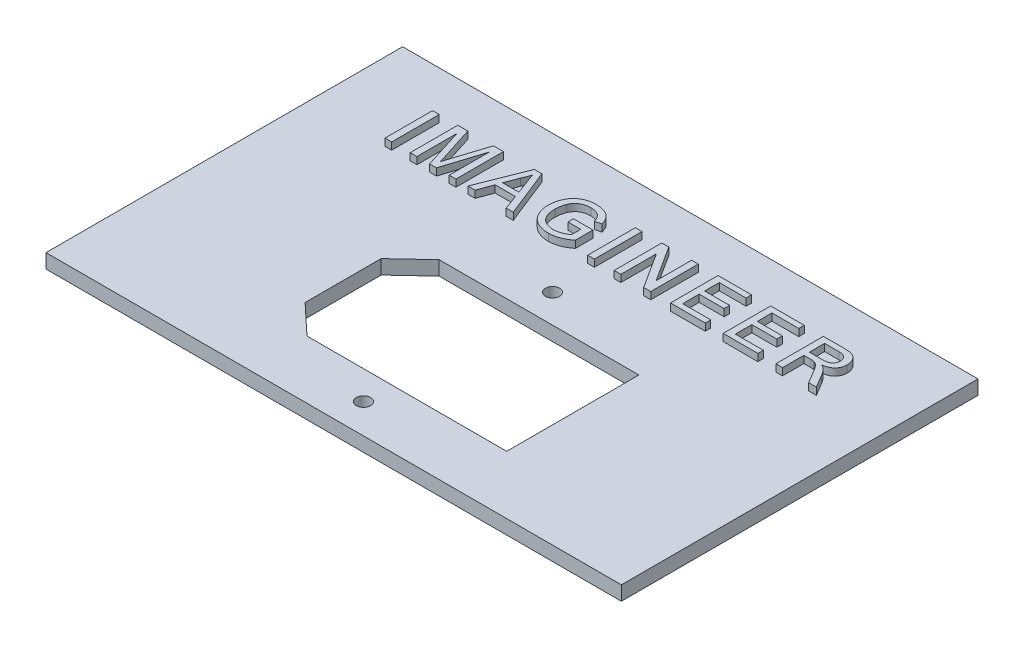
from build123d import *

# Parameters (mm, degrees)
SKETCH1_W           = 121
SKETCH1_H           = 75
BOSS_EXTRUDE1_DEPTH = 58
SKETCH2_W           = 115
SKETCH2_H           = 52
CUT_EXTRUDE1_DEPTH  = 72
SKETCH4_W           = 1.41025641
SKETCH4_H           = 10
BOSS_EXTRUDE2_DEPTH = 1.5
SKETCH5_R           = 1.489811861
SKETCH5_R_2         = 1.5
CUT_EXTRUDE2_DEPTH  = 5
SKETCH6_W           = 75
SKETCH6_H           = 3
BOSS_EXTRUDE3_DEPTH = 20
SKETCH7_R           = 2.5
CUT_EXTRUDE3_DEPTH  = 20
SKETCH8_R           = 7.5
CUT_EXTRUDE4_DEPTH  = 5
SKETCH9_R           = 1.75
CUT_EXTRUDE5_DEPTH  = 5
SKETCH11_W          = 152.738071066
SKETCH11_H          = 55
CUT_EXTRUDE7_DEPTH  = 171.429604315


with BuildPart() as part:
    # Sketch1 → Boss-Extrude1 (new body)
    with BuildSketch(Plane(origin=(0, 0, 0), x_dir=(1, 0, 0), z_dir=(0, 1, 0))):
        with Locations((60.5, 37.5)):
            Rectangle(SKETCH1_W, SKETCH1_H)
    extrude(amount=BOSS_EXTRUDE1_DEPTH)

    # Sketch2 → Cut-Extrude1 (cut)
    with BuildSketch(Plane(origin=(0, 0, -75), x_dir=(-1, 0, 0), z_dir=(0, 0, -1))):
        with Locations((-60.5, 29)):
            Rectangle(SKETCH2_W, SKETCH2_H)
    extrude(amount=-CUT_EXTRUDE1_DEPTH, mode=Mode.SUBTRACT)

    # Sketch4 → Boss-Extrude2 (add)
    # profile 1 of 9: a face of its own
    with BuildSketch(Plane(origin=(0, 58, 0), x_dir=(1, 0, 0), z_dir=(0, 1, 0))):
        with Locations((16.987179487, 60)):
            Rectangle(SKETCH4_W, SKETCH4_H)
    # profile 2 of 9: a face of its own
    with BuildSketch(Plane(origin=(0, 58, 0), x_dir=(1, 0, 0), z_dir=(0, 1, 0))):
        with BuildLine():
            Line((21.58974359, 55), (21.58974359, 65))
            Line((21.58974359, 65), (23.711137821, 65))
            Line((23.711137821, 65), (25.946714744, 57.982772436))
            add(Edge.make_bspline(
                [(25.946714744, 57.982772436), (25.971317363, 57.903279477), (26.018897396, 57.749544721), (26.08945294, 57.527537588), (26.153646657, 57.321231721), (26.211463207, 57.129970438), (26.266025433, 56.954703341), (26.313267723, 56.793992236), (26.358432889, 56.649622979), (26.384901695, 56.557871596), (26.397435897, 56.514423077)],
                knots=[0, 0, 0, 0, 1.300204174, 2.514519184, 3.639827924, 4.676153899, 5.636536826, 6.507959918, 7.293450077, 8, 8, 8, 8], degree=3))
            add(Edge.make_bspline(
                [(26.397435897, 56.514423077), (26.411396089, 56.561850935), (26.441104268, 56.662780451), (26.489265976, 56.821474812), (26.540511404, 56.997087981), (26.601836474, 57.186601452), (26.665760601, 57.392988098), (26.732857292, 57.61607652), (26.810252019, 57.853639448), (26.861684683, 58.018107915), (26.888221154, 58.102964744)],
                knots=[0, 0, 0, 0, 0.713638162, 1.518667645, 2.393860736, 3.354087503, 4.393659122, 5.512594909, 6.716633584, 8, 8, 8, 8], degree=3))
            Line((26.888221154, 58.102964744), (29.101762821, 65))
            Line((29.101762821, 65), (31.205128205, 65))
            Line((31.205128205, 65), (31.205128205, 55))
            Line((31.205128205, 55), (29.794871795, 55))
            Line((29.794871795, 55), (29.794871795, 63.461538462))
            Line((29.794871795, 63.461538462), (27.126602564, 55))
            Line((27.126602564, 55), (25.65224359, 55))
            Line((25.65224359, 55), (23, 63.461538462))
            Line((23, 63.461538462), (23, 55))
            Line((23, 55), (21.58974359, 55))
        make_face()
    # profile 3 of 9: a face of its own
    with BuildSketch(Plane(origin=(0, 58, 0), x_dir=(1, 0, 0), z_dir=(0, 1, 0))):
        Polygon((33.734375, 55), (37.704727564, 65), (39.295272436, 65), (43.265625, 55), (41.769230769, 55), (40.631410256, 58.076923077), (36.368589744, 58.076923077), (35.230769231, 55), align=None)
        with BuildLine():
            Line((36.793269231, 59.230769231), (40.206730769, 59.230769231))
            Line((40.206730769, 59.230769231), (39.235176282, 61.858974359))
            add(Edge.make_bspline(
                [(39.235176282, 61.858974359), (39.197930352, 61.960524623), (39.125107525, 62.159074565), (39.016506752, 62.447550868), (38.917290835, 62.721499806), (38.820001481, 62.976993344), (38.732176644, 63.217742781), (38.65122624, 63.442121964), (38.571166974, 63.648571351), (38.523122282, 63.781958927), (38.5, 63.846153846)],
                knots=[0, 0, 0, 0, 1.225184869, 2.395467751, 3.491410812, 4.525364584, 5.492066482, 6.394148129, 7.227157926, 8, 8, 8, 8], degree=3))
            add(Edge.make_bspline(
                [(38.5, 63.846153846), (38.461751283, 63.687854829), (38.385096138, 63.370604078), (38.224598927, 62.905789169), (38.040995692, 62.445225202), (37.891887987, 62.148440925), (37.816907051, 61.999198718)],
                knots=[0, 0, 0, 0, 0.9891762, 1.982431084, 2.985436691, 4, 4, 4, 4], degree=3))
            Line((37.816907051, 61.999198718), (36.793269231, 59.230769231))
        make_face(mode=Mode.SUBTRACT)
    # profile 4 of 9: a face of its own
    with BuildSketch(Plane(origin=(0, 58, 0), x_dir=(1, 0, 0), z_dir=(0, 1, 0))):
        with BuildLine():
            Line((50.794871795, 58.974358974), (50.794871795, 60.128205128))
            Line((50.794871795, 60.128205128), (54.897435897, 60.128205128))
            Line((54.897435897, 60.128205128), (54.897435897, 56.428285256))
            add(Edge.make_bspline(
                [(54.897435897, 56.428285256), (54.73556896, 56.305002849), (54.416994741, 56.062367775), (53.917376037, 55.745937247), (53.409562732, 55.477566549), (52.894958248, 55.256008429), (52.371793817, 55.085009754), (51.842328107, 54.962612928), (51.305984536, 54.885088148), (50.945369884, 54.876229875), (50.764823718, 54.871794872)],
                knots=[0, 0, 0, 0, 1.08433114, 2.134098231, 3.14842993, 4.143565882, 5.117308249, 6.078377492, 7.037916032, 8, 8, 8, 8], degree=3))
            add(Edge.make_bspline(
                [(50.764823718, 54.871794872), (50.64389522, 54.87365123), (50.40366656, 54.877338949), (50.047995823, 54.908887566), (49.700630006, 54.955764326), (49.362227986, 55.024694072), (49.031595068, 55.112449203), (48.709368093, 55.220898845), (48.395411996, 55.347451318), (48.091476855, 55.49253813), (47.802131001, 55.658770426), (47.528170608, 55.841031042), (47.273051762, 56.0420657), (47.036381783, 56.260230047), (46.819016407, 56.496822026), (46.617735084, 56.748697136), (46.437936839, 57.020470861), (46.275651434, 57.307144136), (46.132352841, 57.606547618), (46.007233593, 57.916126264), (45.903810689, 58.235137402), (45.817554604, 58.562169756), (45.748959138, 58.897100071), (45.701047331, 59.240978048), (45.672844116, 59.593540684), (45.668739297, 59.831680225), (45.666666667, 59.951923077)],
                knots=[0, 0, 0, 0, 1.072770755, 2.131096365, 3.165876834, 4.181397123, 5.193125461, 6.199217581, 7.195986042, 8.195005739, 9.184865672, 10.154356418, 11.112044544, 12.063776475, 13.007136321, 13.960176652, 14.921449994, 15.895149614, 16.88092309, 17.86448639, 18.855604391, 19.854360534, 20.864074582, 21.88711945, 22.933151623, 24, 24, 24, 24], degree=3))
            add(Edge.make_bspline(
                [(45.666666667, 59.951923077), (45.668744997, 60.071498178), (45.672872481, 60.308969721), (45.701316611, 60.662837854), (45.749403968, 61.01051012), (45.815790489, 61.352185335), (45.899570126, 61.687567122), (46.003941343, 62.016720404), (46.128812684, 62.339343656), (46.270237862, 62.654755101), (46.427750978, 62.958441784), (46.60863962, 63.240698377), (46.798821071, 63.508119853), (47.013985843, 63.749080405), (47.239158795, 63.976021204), (47.485357478, 64.178003002), (47.746376315, 64.361105929), (48.023344215, 64.523362037), (48.314631955, 64.664963992), (48.616763548, 64.789673635), (48.930424699, 64.893159395), (49.253817605, 64.980468389), (49.588734219, 65.045340341), (49.934311274, 65.094139841), (50.290939241, 65.12201267), (50.532405627, 65.126123852), (50.654647436, 65.128205128)],
                knots=[0, 0, 0, 0, 1.059979929, 2.105079288, 3.144800512, 4.169876923, 5.189194625, 6.207600986, 7.228841866, 8.254191695, 9.270945245, 10.257936415, 11.22408152, 12.176290364, 13.118065146, 14.055588944, 14.994904974, 15.942096138, 16.897776019, 17.864011786, 18.837383209, 19.823806203, 20.831455606, 21.859450402, 22.916351634, 24, 24, 24, 24], degree=3))
            add(Edge.make_bspline(
                [(50.654647436, 65.128205128), (50.831115136, 65.123959635), (51.175909745, 65.115664501), (51.68071161, 65.051149166), (52.158134205, 64.940754438), (52.536487652, 64.813922736), (52.8206613, 64.690323441), (53.021530624, 64.590430295), (53.21034398, 64.481348357), (53.389274769, 64.366622463), (53.554327508, 64.238724287), (53.707670997, 64.103667865), (53.84970877, 63.959833891), (54.024578118, 63.754555172), (54.224621182, 63.469402744), (54.425338507, 63.082182228), (54.601142318, 62.650536201), (54.688153937, 62.341423111), (54.733173077, 62.181490385)],
                knots=[0, 0, 0, 0, 1.539867261, 3.008697525, 4.432261777, 5.810773619, 6.484177873, 7.135742803, 7.767512201, 8.386601754, 8.989234153, 9.587908519, 10.168964172, 10.7517707, 11.940093668, 13.199243526, 14.550910222, 16, 16, 16, 16], degree=3))
            Line((54.733173077, 62.181490385), (53.443108974, 61.856971154))
            add(Edge.make_bspline(
                [(53.443108974, 61.856971154), (53.405874484, 61.975646851), (53.334562136, 62.202937264), (53.208953288, 62.520609667), (53.062629557, 62.794917237), (52.906173437, 63.03636924), (52.719779789, 63.244075818), (52.503369428, 63.428118249), (52.250462487, 63.587953021), (51.966628117, 63.724803039), (51.658050303, 63.836552659), (51.329620599, 63.916187516), (50.984682955, 63.965713987), (50.748968599, 63.971436756), (50.628605769, 63.974358974)],
                knots=[0, 0, 0, 0, 1.164883671, 2.23101188, 3.193404931, 4.072828119, 4.918883984, 5.797350418, 6.725503451, 7.712871826, 8.743577122, 9.793233972, 10.87315899, 12, 12, 12, 12], degree=3))
            add(Edge.make_bspline(
                [(50.628605769, 63.974358974), (50.486232797, 63.970769984), (50.21058126, 63.963821259), (49.811123469, 63.914008077), (49.441465873, 63.829030609), (49.102847471, 63.707944881), (48.796690432, 63.559104982), (48.518614342, 63.390799982), (48.273333297, 63.198120431), (48.059914961, 62.983524042), (47.874312424, 62.753957932), (47.708805657, 62.514669015), (47.564876039, 62.263726715), (47.488000882, 62.087442093), (47.449519231, 61.999198718)],
                knots=[0, 0, 0, 0, 1.282088634, 2.482280855, 3.618640035, 4.691464057, 5.71354971, 6.679981643, 7.61357903, 8.515091979, 9.399860987, 10.268958177, 11.133486685, 12, 12, 12, 12], degree=3))
            add(Edge.make_bspline(
                [(47.449519231, 61.999198718), (47.392055005, 61.843994267), (47.276389513, 61.5315947), (47.16339573, 61.039243874), (47.090456723, 60.528375998), (47.081479537, 60.180549305), (47.076923077, 60.00400641)],
                knots=[0, 0, 0, 0, 0.971932623, 1.956331326, 2.96271565, 4, 4, 4, 4], degree=3))
            add(Edge.make_bspline(
                [(47.076923077, 60.00400641), (47.077613597, 59.895781102), (47.078966349, 59.683764253), (47.103212206, 59.372463708), (47.134914439, 59.073836949), (47.186365485, 58.789348439), (47.247536072, 58.518150279), (47.323409115, 58.260094134), (47.416152527, 58.016468037), (47.519741217, 57.784886293), (47.638264501, 57.567850479), (47.770253043, 57.365591733), (47.915216958, 57.178217942), (48.072661906, 57.005522406), (48.240252343, 56.844036102), (48.423236889, 56.699921497), (48.619557882, 56.571085484), (48.89498827, 56.417657457), (49.258151731, 56.262770224), (49.70831801, 56.124579887), (50.173570392, 56.042505126), (50.488064727, 56.031293828), (50.646634615, 56.025641026)],
                knots=[0, 0, 0, 0, 1.070760406, 2.097653971, 3.088708526, 4.041547766, 4.95691435, 5.839291284, 6.700934147, 7.534993757, 8.348268852, 9.145600082, 9.922850605, 10.690119832, 11.456705726, 12.223547942, 12.991528328, 13.778467112, 15.341275849, 16.888285822, 18.431055468, 20, 20, 20, 20], degree=3))
            add(Edge.make_bspline(
                [(50.646634615, 56.025641026), (50.785735052, 56.030218875), (51.063294813, 56.039353473), (51.476523468, 56.102740525), (51.883255685, 56.210373903), (52.27650153, 56.355690977), (52.644357284, 56.52213959), (52.96997267, 56.700489064), (53.252725699, 56.878452619), (53.411773916, 57.014721263), (53.487179487, 57.079326923)],
                knots=[0, 0, 0, 0, 1.08078364, 2.156585965, 3.240205791, 4.344938036, 5.41078367, 6.374425311, 7.229306744, 8, 8, 8, 8], degree=3))
            Line((53.487179487, 57.079326923), (53.487179487, 58.974358974))
            Line((53.487179487, 58.974358974), (50.794871795, 58.974358974))
        make_face()
    # profile 5 of 9: a face of its own
    with BuildSketch(Plane(origin=(0, 58, 0), x_dir=(1, 0, 0), z_dir=(0, 1, 0))):
        with Locations((59.628205128, 60)):
            Rectangle(SKETCH4_W, SKETCH4_H)
    # profile 6 of 9: a face of its own
    with BuildSketch(Plane(origin=(0, 58, 0), x_dir=(1, 0, 0), z_dir=(0, 1, 0))):
        Polygon((64.487179487, 55), (64.487179487, 65), (65.977564103, 65), (70.769230769, 57.538060897), (70.769230769, 65), (72.179487179, 65), (72.179487179, 55), (70.689102564, 55), (65.897435897, 62.461939103), (65.897435897, 55), align=None)
    # profile 7 of 9: a face of its own
    with BuildSketch(Plane(origin=(0, 58, 0), x_dir=(1, 0, 0), z_dir=(0, 1, 0))):
        Polygon((76.333333333, 55), (76.333333333, 65), (83.384615385, 65), (83.384615385, 63.846153846), (77.743589744, 63.846153846), (77.743589744, 60.769230769), (83, 60.769230769), (83, 59.615384615), (77.743589744, 59.615384615), (77.743589744, 56.153846154), (83.641025641, 56.153846154), (83.641025641, 55), align=None)
    # profile 8 of 9: a face of its own
    with BuildSketch(Plane(origin=(0, 58, 0), x_dir=(1, 0, 0), z_dir=(0, 1, 0))):
        Polygon((87.41025641, 55), (87.41025641, 65), (94.461538462, 65), (94.461538462, 63.846153846), (88.820512821, 63.846153846), (88.820512821, 60.769230769), (94.076923077, 60.769230769), (94.076923077, 59.615384615), (88.820512821, 59.615384615), (88.820512821, 56.153846154), (94.717948718, 56.153846154), (94.717948718, 55), align=None)
    # profile 9 of 9: a face of its own
    with BuildSketch(Plane(origin=(0, 58, 0), x_dir=(1, 0, 0), z_dir=(0, 1, 0))):
        with BuildLine():
            Line((98.487179487, 55), (98.487179487, 65))
            Line((98.487179487, 65), (102.826121795, 65))
            add(Edge.make_bspline(
                [(102.826121795, 65), (102.9282906, 64.999199465), (103.126026365, 64.997650124), (103.412784052, 64.986682545), (103.680443606, 64.963039323), (103.929497162, 64.937472473), (104.159900472, 64.898230774), (104.371415834, 64.853221431), (104.564369817, 64.799659632), (104.739625043, 64.736399019), (104.902223679, 64.664829112), (105.052940331, 64.576523403), (105.198040099, 64.479759173), (105.332137823, 64.366075645), (105.458770343, 64.241602704), (105.577820293, 64.104649027), (105.687525233, 63.954026134), (105.822833139, 63.738453539), (105.967990935, 63.451356238), (106.088930179, 63.083933901), (106.16690964, 62.699596725), (106.175253665, 62.436946788), (106.179487179, 62.303685897)],
                knots=[0, 0, 0, 0, 1.242255013, 2.404239178, 3.487702428, 4.508875116, 5.447164253, 6.327763259, 7.137389581, 7.87956647, 8.591787438, 9.293660819, 10.000726923, 10.709654955, 11.427269343, 12.158170644, 12.913245971, 13.690346794, 15.251572448, 16.809945773, 18.381459854, 20, 20, 20, 20], degree=3))
            add(Edge.make_bspline(
                [(106.179487179, 62.303685897), (106.177530353, 62.21814429), (106.173665487, 62.04919375), (106.144060224, 61.800791233), (106.090491892, 61.563452617), (106.021801064, 61.335099332), (105.927784275, 61.118966781), (105.818869907, 60.910640388), (105.683940489, 60.715843438), (105.532872085, 60.529388798), (105.359637137, 60.355269829), (105.162711701, 60.199768316), (104.944047853, 60.059894394), (104.702615774, 59.939507239), (104.44119459, 59.829467663), (104.156504185, 59.740858495), (103.849693543, 59.668502315), (103.636998145, 59.63346466), (103.52724359, 59.615384615)],
                knots=[0, 0, 0, 0, 0.982609109, 1.940720374, 2.867584677, 3.775009516, 4.675469332, 5.571146231, 6.471115823, 7.392408543, 8.32534739, 9.286126426, 10.269214477, 11.301811357, 12.381622301, 13.524260118, 14.722474812, 16, 16, 16, 16], degree=3))
            add(Edge.make_bspline(
                [(103.52724359, 59.615384615), (103.607752714, 59.574713182), (103.760642439, 59.497476665), (103.972320158, 59.376370478), (104.151752032, 59.252629797), (104.25570601, 59.164126826), (104.304487179, 59.122596154)],
                knots=[0, 0, 0, 0, 1.172304973, 2.226249348, 3.167654437, 4, 4, 4, 4], degree=3))
            add(Edge.make_bspline(
                [(104.304487179, 59.122596154), (104.398954671, 59.029990406), (104.59299761, 58.83977162), (104.860397207, 58.515773306), (105.119650301, 58.155113465), (105.277166103, 57.894463376), (105.358173077, 57.760416667)],
                knots=[0, 0, 0, 0, 0.918110279, 1.885863737, 2.912745394, 4, 4, 4, 4], degree=3))
            Line((105.358173077, 57.760416667), (106.998798077, 55))
            Line((106.998798077, 55), (105.382211538, 55))
            Line((105.382211538, 55), (104.136217949, 57.111378205))
            add(Edge.make_bspline(
                [(104.136217949, 57.111378205), (104.091418278, 57.185458447), (104.004603872, 57.329013793), (103.879203572, 57.538669464), (103.756252701, 57.731690915), (103.642217872, 57.913594803), (103.532471359, 58.081078753), (103.428073571, 58.234724571), (103.331897581, 58.376547891), (103.212771184, 58.541667143), (103.074127843, 58.724373128), (102.912340577, 58.912525791), (102.758271131, 59.062537403), (102.568531766, 59.209639746), (102.333510857, 59.347229261), (102.133738647, 59.410447864), (102.036858974, 59.441105769)],
                knots=[0, 0, 0, 0, 1.130940588, 2.191577161, 3.191089816, 4.120344442, 4.99615009, 5.80661983, 6.546979556, 7.234477901, 8.466216387, 9.541989141, 10.473533583, 11.269175393, 12.675684693, 14, 14, 14, 14], degree=3))
            add(Edge.make_bspline(
                [(102.036858974, 59.441105769), (101.996211854, 59.448435826), (101.90341326, 59.465170567), (101.74584148, 59.476100052), (101.554923936, 59.487700239), (101.416562739, 59.487362249), (101.341746795, 59.487179487)],
                knots=[0, 0, 0, 0, 0.709978628, 1.620902492, 2.713552433, 4, 4, 4, 4], degree=3))
            Line((101.341746795, 59.487179487), (99.897435897, 59.487179487))
            Line((99.897435897, 59.487179487), (99.897435897, 55))
            Line((99.897435897, 55), (98.487179487, 55))
        make_face()
        with BuildLine():
            Line((99.897435897, 60.641025641), (102.575721154, 60.641025641))
            add(Edge.make_bspline(
                [(102.575721154, 60.641025641), (102.710020522, 60.643126882), (102.961080593, 60.647054955), (103.312148386, 60.680596569), (103.611336258, 60.733895618), (103.864558726, 60.811638523), (104.07730557, 60.919571492), (104.262335542, 61.051107984), (104.416097778, 61.215871133), (104.544012075, 61.401771268), (104.643442482, 61.606345087), (104.715166835, 61.82121989), (104.762111672, 62.044589794), (104.766836719, 62.196612258), (104.769230769, 62.273637821)],
                knots=[0, 0, 0, 0, 1.546323217, 2.890706218, 4.056530419, 5.041445823, 5.928701482, 6.793137403, 7.641659452, 8.509781392, 9.383301667, 10.251423607, 11.114044887, 12, 12, 12, 12], degree=3))
            add(Edge.make_bspline(
                [(104.769230769, 62.273637821), (104.767369495, 62.329769277), (104.763723806, 62.43971431), (104.744611897, 62.601083093), (104.707453809, 62.754420737), (104.658386644, 62.9005378), (104.592822956, 63.03836408), (104.514935969, 63.168967578), (104.421992748, 63.291624437), (104.315531637, 63.406708289), (104.193294934, 63.511423347), (104.053671883, 63.601769729), (103.897763681, 63.678544664), (103.725389111, 63.739478385), (103.537091185, 63.788215443), (103.331797963, 63.820638635), (103.110448296, 63.844099949), (102.957065813, 63.845456423), (102.878205128, 63.846153846)],
                knots=[0, 0, 0, 0, 0.965208469, 1.890559848, 2.786986821, 3.67262109, 4.535197034, 5.405224191, 6.282113641, 7.175449223, 8.095446547, 9.040936516, 10.026471658, 11.075712529, 12.17809725, 13.364958037, 14.645208957, 16, 16, 16, 16], degree=3))
            Line((102.878205128, 63.846153846), (99.897435897, 63.846153846))
            Line((99.897435897, 63.846153846), (99.897435897, 60.641025641))
        make_face(mode=Mode.SUBTRACT)
    extrude(amount=BOSS_EXTRUDE2_DEPTH)

    # Sketch5 → Cut-Extrude2 (cut)
    with BuildSketch(Plane(origin=(0, 58, 0), x_dir=(-1, 0, 0), z_dir=(0, 1, 0))):
        with Locations(Location((-60.478143675, -46.04301681, 0), (0, 0, 90))):
            Circle(SKETCH5_R)
        with Locations(Location((-60.506522325, -6.250393675, 0), (0, 0, 90))):
            Circle(SKETCH5_R_2)
        Polygon((-84.629004206, -12.253075019), (-42.629004206, -12.253075019), (-36.329004969, -18.153076545), (-36.329004969, -34.153074638), (-42.629004206, -40.05307521), (-84.629004206, -40.05307521), align=None)
    extrude(amount=-CUT_EXTRUDE2_DEPTH, mode=Mode.SUBTRACT)

    # Sketch6 → Boss-Extrude3 (add)
    with BuildSketch(Plane(origin=(121, 0, 0), x_dir=(0, 0, -1), z_dir=(1, 0, 0))):
        with Locations((37.5, 1.5)):
            Rectangle(SKETCH6_W, SKETCH6_H)
    extrude(amount=BOSS_EXTRUDE3_DEPTH)

    # Sketch7 → Cut-Extrude3 (cut)
    with BuildSketch(Plane(origin=(0, 3, 0), x_dir=(1, 0, 0), z_dir=(0, 1, 0))):
        with Locations(Location((131, 63, 0), (0, 0, 270))):
            Circle(SKETCH7_R)
        with Locations(Location((131, 37.5, 0), (0, 0, 270))):
            Circle(SKETCH7_R)
        with Locations(Location((131, 12, 0), (0, 0, 270))):
            Circle(SKETCH7_R)
    extrude(amount=-CUT_EXTRUDE3_DEPTH, mode=Mode.SUBTRACT)

    # Sketch8 → Cut-Extrude4 (cut)
    with BuildSketch(Plane.XY):
        with Locations((77.955583756, 29)):
            Circle(SKETCH8_R)
    extrude(amount=-CUT_EXTRUDE4_DEPTH, mode=Mode.SUBTRACT)

    # Sketch9 → Cut-Extrude5 (cut)
    with BuildSketch(Plane.XZ):
        with Locations(Location((11, -60, 0), (0, 0, 270))):
            Circle(SKETCH9_R)
        with Locations(Location((110, -60, 0), (0, 0, 270))):
            Circle(SKETCH9_R)
    extrude(amount=-CUT_EXTRUDE5_DEPTH, mode=Mode.SUBTRACT)

    # Sketch11 → Cut-Extrude7 (cut, through all)
    with BuildSketch(Plane.XY):
        with Locations((76.369035533, 27.5)):
            Rectangle(SKETCH11_W, SKETCH11_H)
    extrude(amount=-CUT_EXTRUDE7_DEPTH, mode=Mode.SUBTRACT)


solid = part.part
